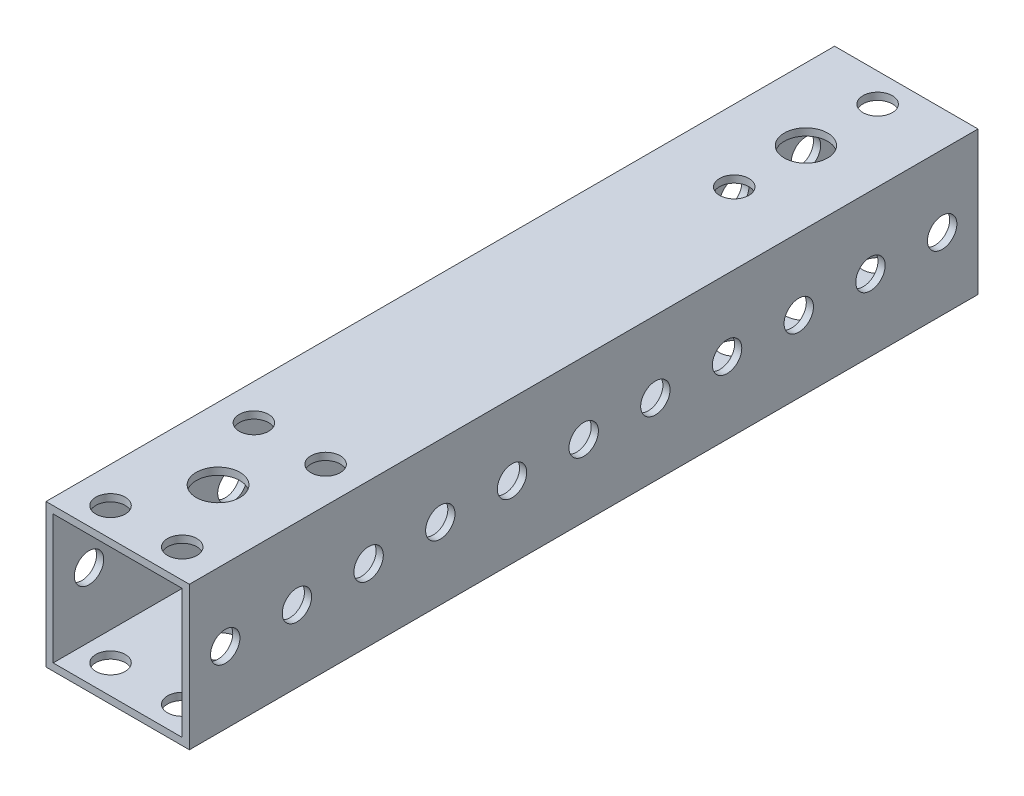
from build123d import *

# Parameters (mm, degrees)
SKETCH_1_W          = 20
SKETCH_1_H          = 20
SKETCH_1_W_2        = 18
SKETCH_1_H_2        = 18
EXTRUDE_1_DEPTH     = 55
SKETCH_3_R          = 2.05
SKETCH_3_R_2        = 3.05
CUT_EXTRUDE_1_DEPTH = 20
SKETCH_4_R          = 2.05
SKETCH_4_R_2        = 3.025
CUT_EXTRUDE_2_DEPTH = 60.371710435
SKETCH_5_R          = 2.05
CUT_EXTRUDE_3_DEPTH = 30


with BuildPart() as part:
    # 草图1 → 凸台-拉伸1 (new, symmetric)
    with BuildSketch(Plane.XY):
        Rectangle(SKETCH_1_W, SKETCH_1_H)
        Rectangle(SKETCH_1_W_2, SKETCH_1_H_2, mode=Mode.SUBTRACT)
    extrude(amount=EXTRUDE_1_DEPTH, both=True)

    # 草图3 → 切除-拉伸1 (cut)
    with BuildSketch(Plane(origin=(0, 10, 0), x_dir=(1, 0, 0), z_dir=(0, 1, 0))):
        with Locations(Location((-5, -31, 0), (0, 0, 270))):
            Circle(SKETCH_3_R)
        with Locations(Location((5, -31, 0), (0, 0, 270))):
            Circle(SKETCH_3_R)
        with Locations(Location((5, -51, 0), (0, 0, 270))):
            Circle(SKETCH_3_R)
        with Locations(Location((-5, -51, 0), (0, 0, 270))):
            Circle(SKETCH_3_R)
        with Locations(Location((0, -41, 0), (0, 0, 270))):
            Circle(SKETCH_3_R_2)
    extrude(amount=-CUT_EXTRUDE_1_DEPTH, mode=Mode.SUBTRACT)

    # 草图4 → 切除-拉伸2 (cut, through all)
    with BuildSketch(Plane.XZ.offset(10)):
        with Locations(Location((0, -51, 0), (0, 0, 270))):
            Circle(SKETCH_4_R)
        with Locations(Location((0, -31, 0), (0, 0, 270))):
            Circle(SKETCH_4_R)
        with Locations(Location((0, -41, 0), (0, 0, 270))):
            Circle(SKETCH_4_R_2)
    extrude(amount=-CUT_EXTRUDE_2_DEPTH, mode=Mode.SUBTRACT)

    # 草图5 → 切除-拉伸3 (cut)
    with BuildSketch(Plane(origin=(10, 0, 0), x_dir=(0, 0, -1), z_dir=(1, 0, 0))):
        with Locations((-50, 0)):
            Circle(SKETCH_5_R)
        with Locations((-40, 0)):
            Circle(SKETCH_5_R)
        with Locations((-30, 0)):
            Circle(SKETCH_5_R)
        with Locations((-20, 0)):
            Circle(SKETCH_5_R)
        with Locations((-10, 0)):
            Circle(SKETCH_5_R)
        Circle(SKETCH_5_R)
        with Locations((10, 0)):
            Circle(SKETCH_5_R)
        with Locations((20, 0)):
            Circle(SKETCH_5_R)
        with Locations((30, 0)):
            Circle(SKETCH_5_R)
        with Locations((40, 0)):
            Circle(SKETCH_5_R)
        with Locations((50, 0)):
            Circle(SKETCH_5_R)
    extrude(amount=-CUT_EXTRUDE_3_DEPTH, mode=Mode.SUBTRACT)


solid = part.part
